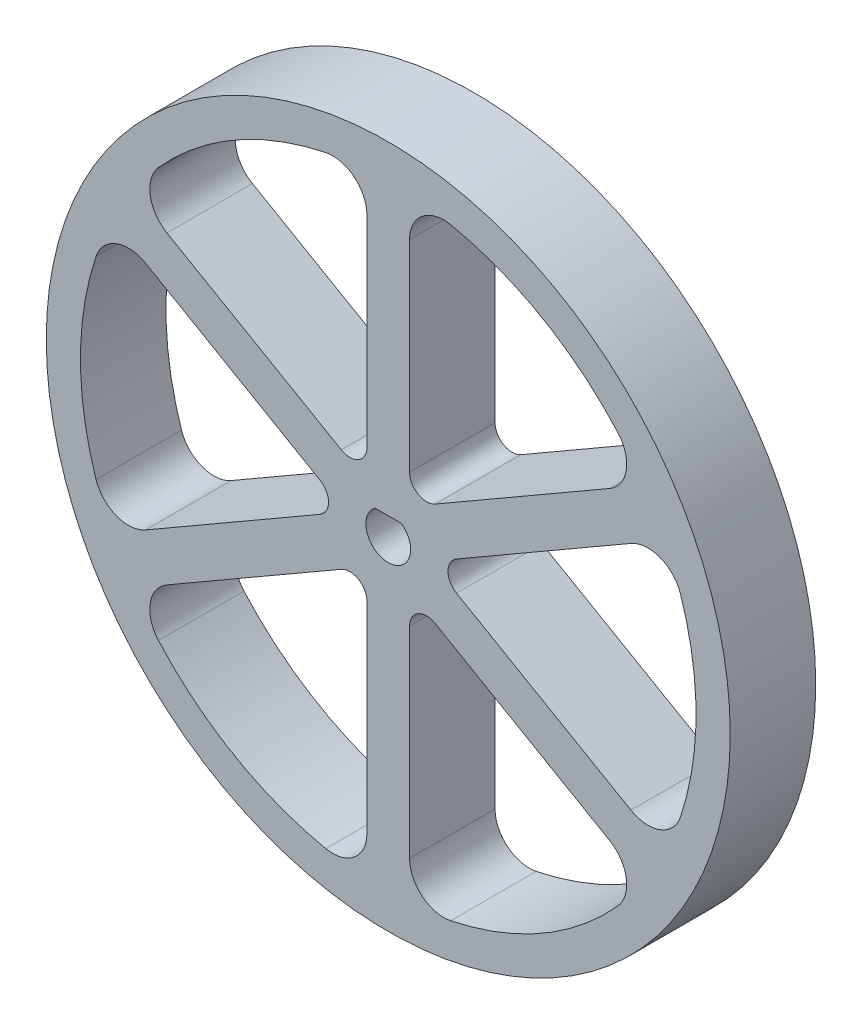
from build123d import *

# Parameters (mm, degrees)
SKETCH1_R           = 40
BOSS_EXTRUDE1_DEPTH = 10
FILLET2_R           = 2
FILLET3_R           = 4


with BuildPart() as part:
    # Sketch1 → Boss-Extrude1 (new body)
    with BuildSketch(Plane.XY):
        Circle(SKETCH1_R)
        with BuildLine():
            Line((-2.4931518, -4.318265588), (-2.4931518, -35.9135656))
            ThreePointArc((-2.4931518, -35.9135656), (-18, -31.176914536), (-29.85548425, -20.115915594))
            Line((-29.85548425, -20.115915594), (-2.4931518, -4.318265588))
        make_face(mode=Mode.SUBTRACT)
        with BuildLine():
            Line((-4.9863036, 0), (-32.34863605, -15.797650006))
            ThreePointArc((-32.34863605, -15.797650006), (-36, 0), (-32.34863605, 15.797650006))
            Line((-32.34863605, 15.797650006), (-4.9863036, 0))
        make_face(mode=Mode.SUBTRACT)
        with BuildLine():
            Line((-2.4931518, 4.318265588), (-29.85548425, 20.115915594))
            ThreePointArc((-29.85548425, 20.115915594), (-18, 31.176914536), (-2.4931518, 35.9135656))
            Line((-2.4931518, 35.9135656), (-2.4931518, 4.318265588))
        make_face(mode=Mode.SUBTRACT)
        with BuildLine():
            Line((2.4931518, 4.318265588), (2.4931518, 35.9135656))
            ThreePointArc((2.4931518, 35.9135656), (18, 31.176914536), (29.85548425, 20.115915594))
            Line((29.85548425, 20.115915594), (2.4931518, 4.318265588))
        make_face(mode=Mode.SUBTRACT)
        with BuildLine():
            Line((4.9863036, 0), (32.34863605, 15.797650006))
            ThreePointArc((32.34863605, 15.797650006), (36, 0), (32.34863605, -15.797650006))
            Line((32.34863605, -15.797650006), (4.9863036, 0))
        make_face(mode=Mode.SUBTRACT)
        with BuildLine():
            Line((2.4931518, -4.318265588), (29.85548425, -20.115915594))
            ThreePointArc((29.85548425, -20.115915594), (18, -31.176914536), (2.4931518, -35.9135656))
            Line((2.4931518, -35.9135656), (2.4931518, -4.318265588))
        make_face(mode=Mode.SUBTRACT)
        with BuildLine():
            ThreePointArc((1.539480432, 2.12), (0, -2.62), (-1.539480432, 2.12))
            Line((-1.539480432, 2.12), (1.539480432, 2.12))
        make_face(mode=Mode.SUBTRACT)
    extrude(amount=BOSS_EXTRUDE1_DEPTH)

    # Fillet2
    fillet2_edges = [part.edges().sort_by_distance(p)[0] for p in [
        (4.9863036, 0, 5),
        (2.4931518, -4.318265588, 5),
        (-2.4931518, -4.318265588, 5),
        (-4.9863036, 0, 5),
        (-2.4931518, 4.318265588, 5),
        (2.4931518, 4.318265588, 5),
    ]]
    fillet(fillet2_edges, radius=FILLET2_R)

    # Fillet3
    fillet3_edges = [part.edges().sort_by_distance(p)[0] for p in [
        (-32.34863605, 15.797650006, 5),
        (-32.34863605, -15.797650006, 5),
        (-29.85548425, -20.115915594, 5),
        (-2.4931518, -35.9135656, 5),
        (2.4931518, -35.9135656, 5),
        (29.85548425, -20.115915594, 5),
        (32.34863605, -15.797650006, 5),
        (32.34863605, 15.797650006, 5),
        (29.85548425, 20.115915594, 5),
        (2.4931518, 35.9135656, 5),
        (-2.4931518, 35.9135656, 5),
        (-29.85548425, 20.115915594, 5),
    ]]
    fillet(fillet3_edges, radius=FILLET3_R)


solid = part.part
